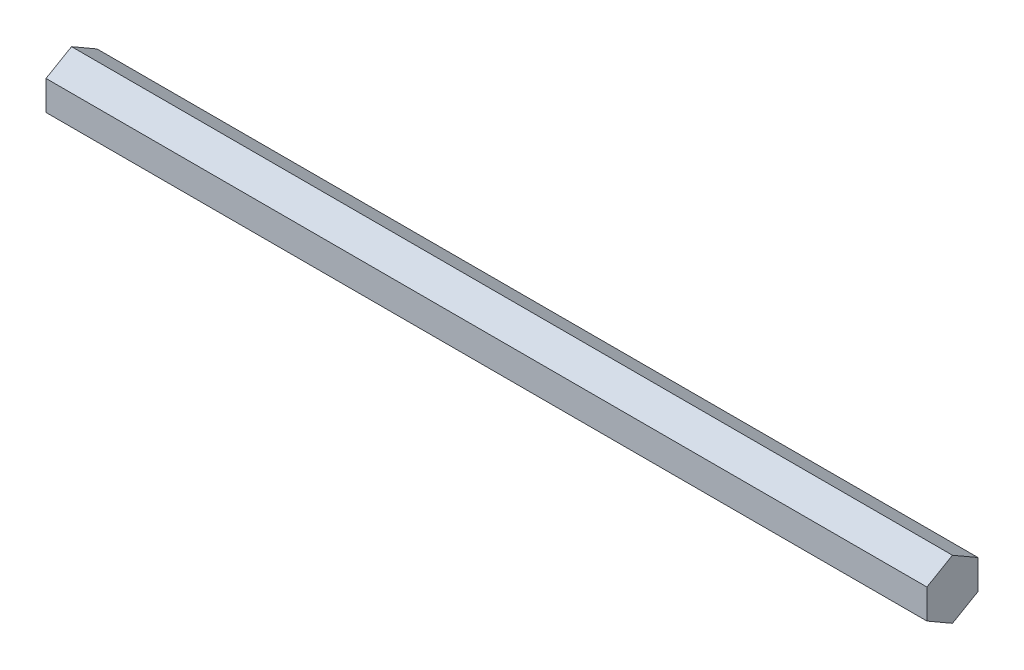
from build123d import *

# Parameters (mm, degrees)
AXLE_DEPTH       = 142.24
DRIVE_SLOT_DEPTH = 13.97


with BuildPart() as part:
    # Hex Profile → Axle (new body)
    with BuildSketch(Plane(origin=(0, 0, 0), x_dir=(0, 0, -1), z_dir=(1, 0, 0))):
        Polygon((4.124445986, -2.38125), (4.124445986, 2.38125), (0, 4.7625), (-4.124445986, 2.38125), (-4.124445986, -2.38125), (0, -4.7625), align=None)
    extrude(amount=AXLE_DEPTH)

    # Motor Shaft Profile → Drive  Slot (cut)
    with BuildSketch(Plane.ZY):
        with BuildLine():
            Line((-1.669458355, 2.4892), (1.669458355, 2.4892))
            ThreePointArc((1.669458355, 2.4892), (0, -2.9972), (-1.669458355, 2.4892))
        make_face()
    extrude(amount=-DRIVE_SLOT_DEPTH, mode=Mode.SUBTRACT)


solid = part.part
